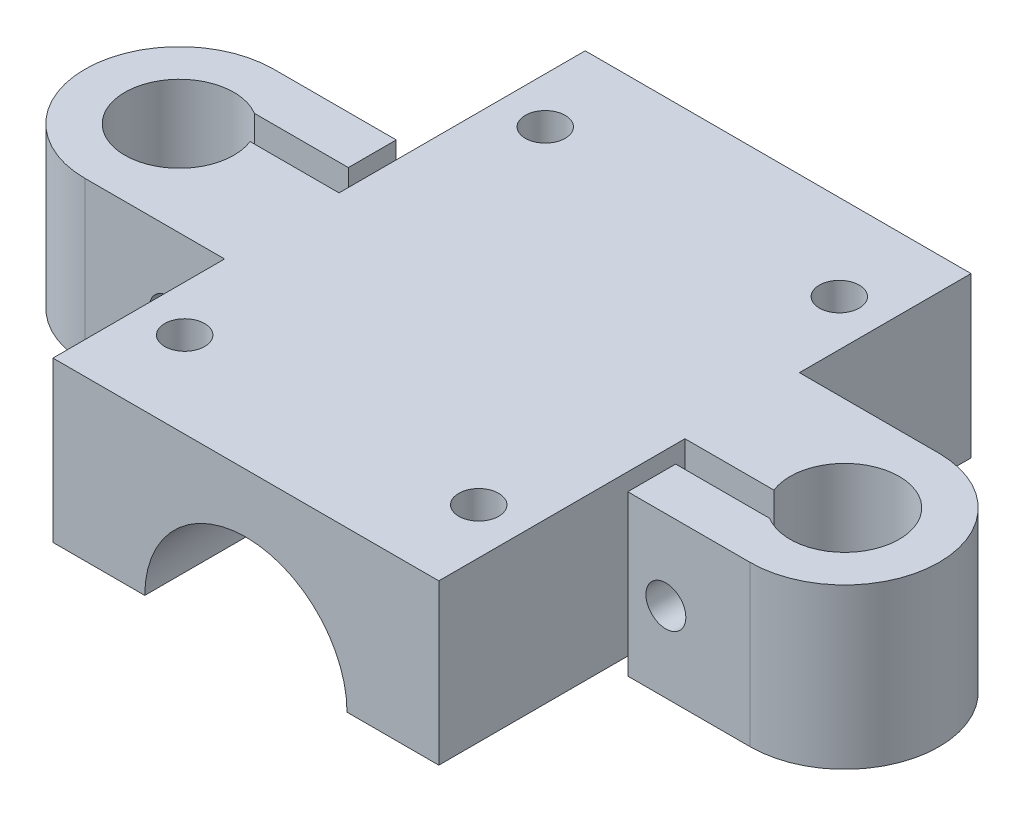
from build123d import *

# Parameters (mm, degrees)
BOSS_EXTRUDE1_DEPTH      = 20
BOSS_EXTRUDE1_DEPTH_BACK = 20
BOSS_EXTRUDE2_DEPTH      = 12
CUT_EXTRUDE1_DEPTH       = 53.704933355
CUT_EXTRUDE1_DEPTH_BACK  = 53.704933355
CUT_EXTRUDE2_DEPTH       = 53.704933355
CUT_EXTRUDE2_DEPTH_BACK  = 53.704933355
SKETCH7_R                = 1.5
CUT_EXTRUDE3_DEPTH       = 53.1110353


with BuildPart() as part:
    # Sketch1 → Boss-Extrude1 (new, two sides: drawn at the far end of the back side and taken through both)
    with BuildSketch(Plane(origin=(0, 0, 0), x_dir=(0, 1, 0), z_dir=(0, 0, 1)).offset(-BOSS_EXTRUDE1_DEPTH_BACK)):
        with BuildLine():
            ThreePointArc((0, -22.1), (7.6, -14.5), (0, -6.9))
            Line((0, -6.9), (0, 0))
            Line((0, 0), (12, 0))
            Line((12, 0), (12, -29))
            Line((12, -29), (0, -29))
            Line((0, -29), (0, -22.1))
        make_face()
    extrude(amount=BOSS_EXTRUDE1_DEPTH + BOSS_EXTRUDE1_DEPTH_BACK)

    # Sketch3 → Boss-Extrude2 (add)
    with BuildSketch(Plane(origin=(0, 12, 0), x_dir=(-1, 0, 0), z_dir=(0, 1, 0))):
        with BuildLine():
            Line((1.3, -7.1), (10.5, -7.1))
            ThreePointArc((10.5, -7.1), (17.6, 0), (10.5, 7.1))
            Line((10.5, 7.1), (0, 7.1))
            Line((0, 7.1), (0, -1.5))
            Line((0, -1.5), (6.684243194, -1.5))
            ThreePointArc((6.684243194, -1.5), (13.639126216, 2.637401486), (8.36458435, -3.5))
            Line((8.36458435, -3.5), (1.3, -3.5))
            Line((1.3, -3.5), (1.3, -7.1))
        make_face()
        with BuildLine():
            Line((-39.5, -7.1), (-29, -7.1))
            Line((-29, -7.1), (-29, 1.5))
            Line((-29, 1.5), (-35.684243194, 1.5))
            ThreePointArc((-35.684243194, 1.5), (-42.639126216, -2.637401486), (-37.36458435, 3.5))
            Line((-37.36458435, 3.5), (-30.3, 3.5))
            Line((-30.3, 3.5), (-30.3, 7.1))
            Line((-30.3, 7.1), (-39.5, 7.1))
            ThreePointArc((-39.5, 7.1), (-46.6, 0), (-39.5, -7.1))
        make_face()
    extrude(amount=-BOSS_EXTRUDE2_DEPTH)

    # Sketch4 → Cut-Extrude1 (cut, two sides: drawn at the far end of the back side and taken through both)
    with BuildSketch(Plane(origin=(0, 0, -1.5), x_dir=(1, 0, 0), z_dir=(0, 0, -1)).offset(-CUT_EXTRUDE1_DEPTH_BACK)):
        with BuildLine():
            ThreePointArc((-2.664243194, -6), (-4.164243194, -4.5), (-5.664243194, -6))
            Line((-5.664243194, -6), (-2.664243194, -6))
        make_face()
        with BuildLine():
            Line((-2.664243194, -6), (-5.664243194, -6))
            ThreePointArc((-5.664243194, -6), (-4.164243194, -7.5), (-2.664243194, -6))
        make_face()
    extrude(amount=CUT_EXTRUDE1_DEPTH + CUT_EXTRUDE1_DEPTH_BACK, mode=Mode.SUBTRACT)

    # Sketch5 → Cut-Extrude2 (cut, two sides: drawn at the far end of the back side and taken through both)
    with BuildSketch(Plane.XY.offset(1.5).offset(-CUT_EXTRUDE2_DEPTH_BACK)):
        with BuildLine():
            ThreePointArc((31.664243194, 6), (33.164243194, 4.5), (34.664243194, 6))
            Line((34.664243194, 6), (31.664243194, 6))
        make_face()
        with BuildLine():
            Line((31.664243194, 6), (34.664243194, 6))
            ThreePointArc((34.664243194, 6), (33.164243194, 7.5), (31.664243194, 6))
        make_face()
    extrude(amount=CUT_EXTRUDE2_DEPTH + CUT_EXTRUDE2_DEPTH_BACK, mode=Mode.SUBTRACT)

    # Sketch7 → Cut-Extrude3 (cut, through all)
    with BuildSketch(Plane.XZ):
        with Locations((3.45, 13.55)):
            Circle(SKETCH7_R)
        with Locations((25.55, -13.55)):
            Circle(SKETCH7_R)
        with Locations((25.55, 13.55)):
            Circle(SKETCH7_R)
        with Locations((3.45, -13.55)):
            Circle(SKETCH7_R)
    extrude(amount=-CUT_EXTRUDE3_DEPTH, mode=Mode.SUBTRACT)


solid = part.part
